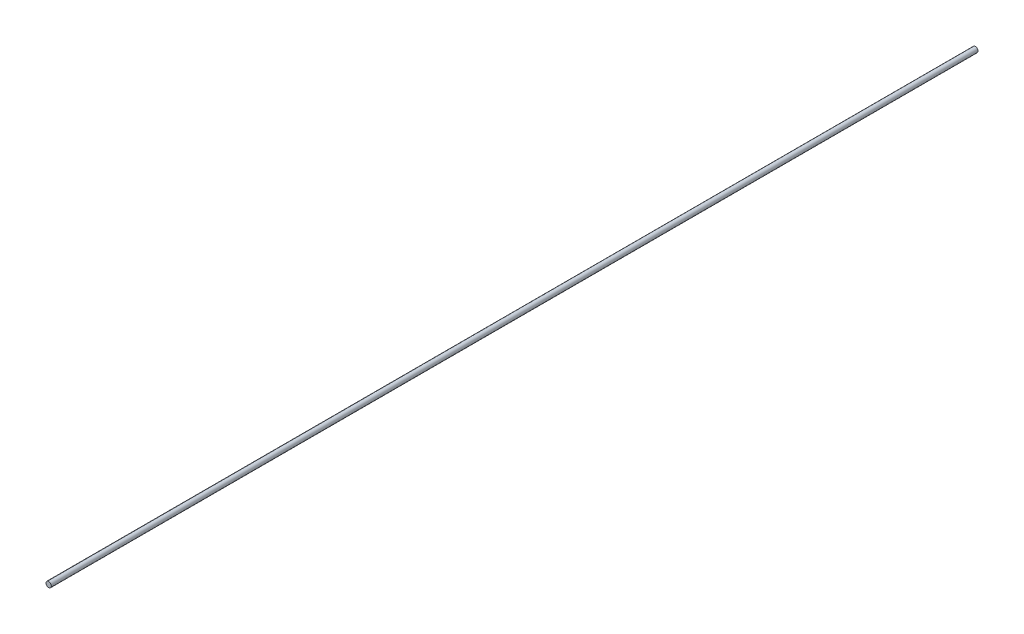
from build123d import *

# Parameters (mm, degrees)
SKETCH1_R           = 3.175
BOSS_EXTRUDE1_DEPTH = 1104.9


with BuildPart() as part:
    # Sketch1 → Boss-Extrude1 (new body)
    with BuildSketch(Plane(origin=(0, 0, 0), x_dir=(0, 1, 0), z_dir=(0, 0, 1))):
        with Locations(Location((0, 0, 0), (0, 0, 270))):
            Circle(SKETCH1_R)
    extrude(amount=BOSS_EXTRUDE1_DEPTH)


solid = part.part
